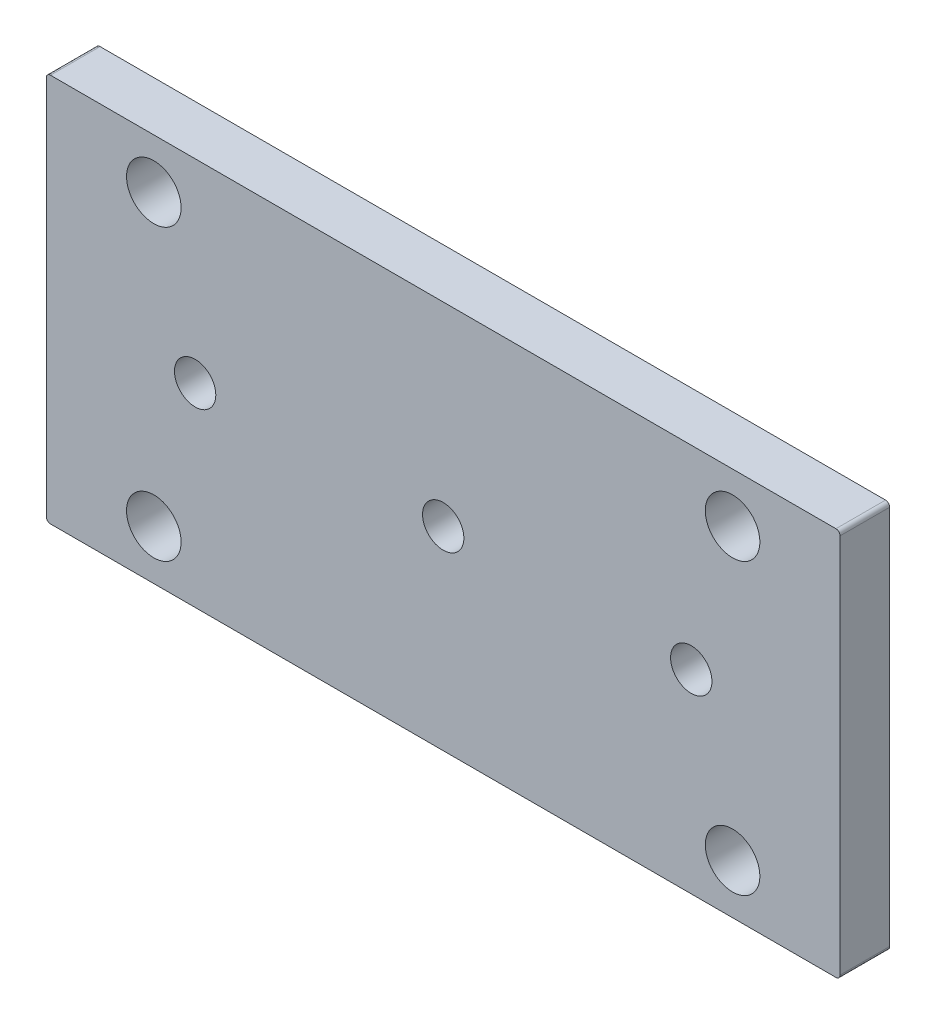
from build123d import *

# Parameters (mm, degrees)
SKETCH_1_W          = 96
SKETCH_1_H          = 47
EXTRUDE_1_DEPTH     = 6
SKETCH_2_R          = 3.3
CUT_EXTRUDE_1_DEPTH = 10
HOLE_WIZARD_M6_2_D  = 5
FILLET_1_R          = 0.5


with BuildPart() as part:
    # 草图1 → 凸台-拉伸1 (new body)
    with BuildSketch(Plane.XY):
        with Locations((48, -23.5)):
            Rectangle(SKETCH_1_W, SKETCH_1_H)
    extrude(amount=EXTRUDE_1_DEPTH)

    # 草图2 → 切除-拉伸1 (cut)
    with BuildSketch(Plane.XY.offset(6)):
        with Locations((83, -6)):
            Circle(SKETCH_2_R)
        with Locations((83, -41)):
            Circle(SKETCH_2_R)
        with Locations((13, -41)):
            Circle(SKETCH_2_R)
        with Locations((13, -6)):
            Circle(SKETCH_2_R)
    extrude(amount=-CUT_EXTRUDE_1_DEPTH, mode=Mode.SUBTRACT)

    # M6 螺纹孔2 (through all)
    with Locations(Plane.XY.offset(6)):
        with Locations((18, -23.5), (48, -23.5), (78, -23.5)):
            Hole(HOLE_WIZARD_M6_2_D / 2)

    # 圆角1
    fillet_1_edges = [part.edges().sort_by_distance(p)[0] for p in [
        (0, 0, 3),
        (96, 0, 3),
        (96, -47, 3),
        (0, -47, 3),
    ]]
    fillet(fillet_1_edges, radius=FILLET_1_R)


solid = part.part
